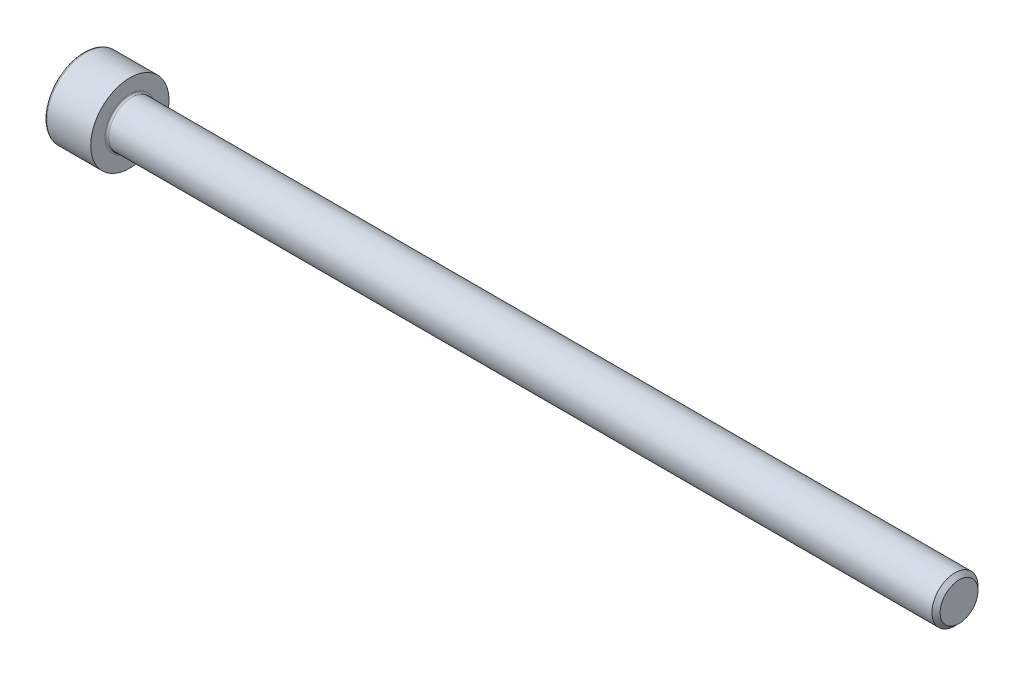
from build123d import *

# Parameters (mm, degrees)
FILLET1_R   = 0.2
FILLET2_R   = 0.25
HEX_2_DEPTH = 2.5


with BuildPart() as part:
    # BodySke → Base-Revolve (revolve)
    with BuildSketch(Plane.XY, mode=Mode.PRIVATE) as base_revolve_sk:
        Polygon((0, 0), (0, 4.25), (5, 4.25), (5, 2.5), (94.555, 2.5), (95, 2.055), (95, 0), align=None)
    revolve(base_revolve_sk.sketch.rotate(Axis((-31.75, 0, 0), (1, 0, 0)), 90), axis=Axis((-31.75, 0, 0), (1, 0, 0)))

    # Fillet1
    fillet1_edges = [part.edges().sort_by_distance(p)[0] for p in [
        (5, 0, -2.5),
    ]]
    fillet(fillet1_edges, radius=FILLET1_R)

    # Fillet2
    fillet2_edges = [part.edges().sort_by_distance(p)[0] for p in [
        (0, 0, -4.25),
    ]]
    fillet(fillet2_edges, radius=FILLET2_R)

    # Sketch2 → Hex-PreBroach (revolve, cut)
    with BuildSketch(Plane.XY, mode=Mode.PRIVATE) as hex_prebroach_sk:
        Polygon((0, 2.042), (2.5, 2.042), (3.67894925, 0), (0, 0), align=None)
    revolve(hex_prebroach_sk.sketch.rotate(Axis((0, 0, 0), (1, 0, 0)), 90), axis=Axis((0, 0, 0), (1, 0, 0)), mode=Mode.SUBTRACT)

    # Sketch3 → Hex 2 (cut)
    with BuildSketch(Plane(origin=(0, 0, 0), x_dir=(0, 0.500000000000001, 0.866025403784438), z_dir=(-1, 0, 0))):
        Polygon((1.17894925, 2.042), (-1.17894925, 2.042), (-2.357898499, 0), (-1.17894925, -2.042), (1.17894925, -2.042), (2.357898499, 0), align=None)
    extrude(amount=-HEX_2_DEPTH, mode=Mode.SUBTRACT)


solid = part.part
